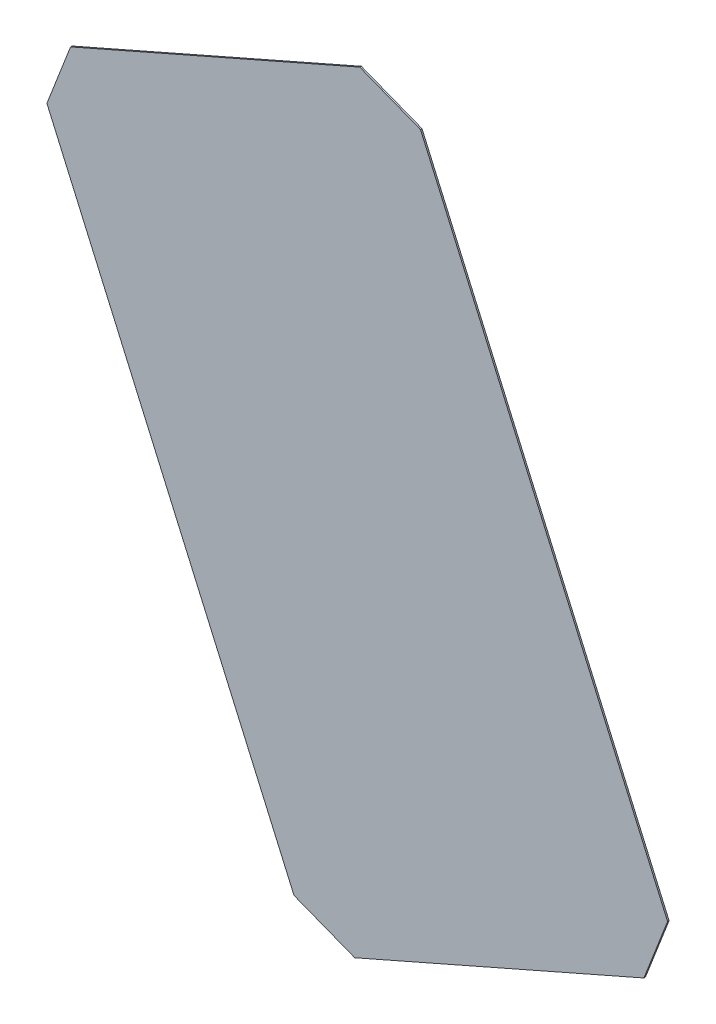
from build123d import *

# Parameters (mm, degrees)
BOSS_EXTRUDE1_DEPTH = 1


with BuildPart() as part:
    # Sketch1 → Boss-Extrude1 (new body)
    with BuildSketch(Plane.XY):
        Polygon((-89.339677143, 491.390488051), (98.983985279, 574.135204932), (138.51753598, 558.737206069), (299.421214894, 192.526875641), (284.02321603, 152.993324941), (95.699553608, 70.248608059), (56.166002907, 85.646606923), (-104.737676007, 451.85693735), align=None)
    extrude(amount=BOSS_EXTRUDE1_DEPTH)


solid = part.part
